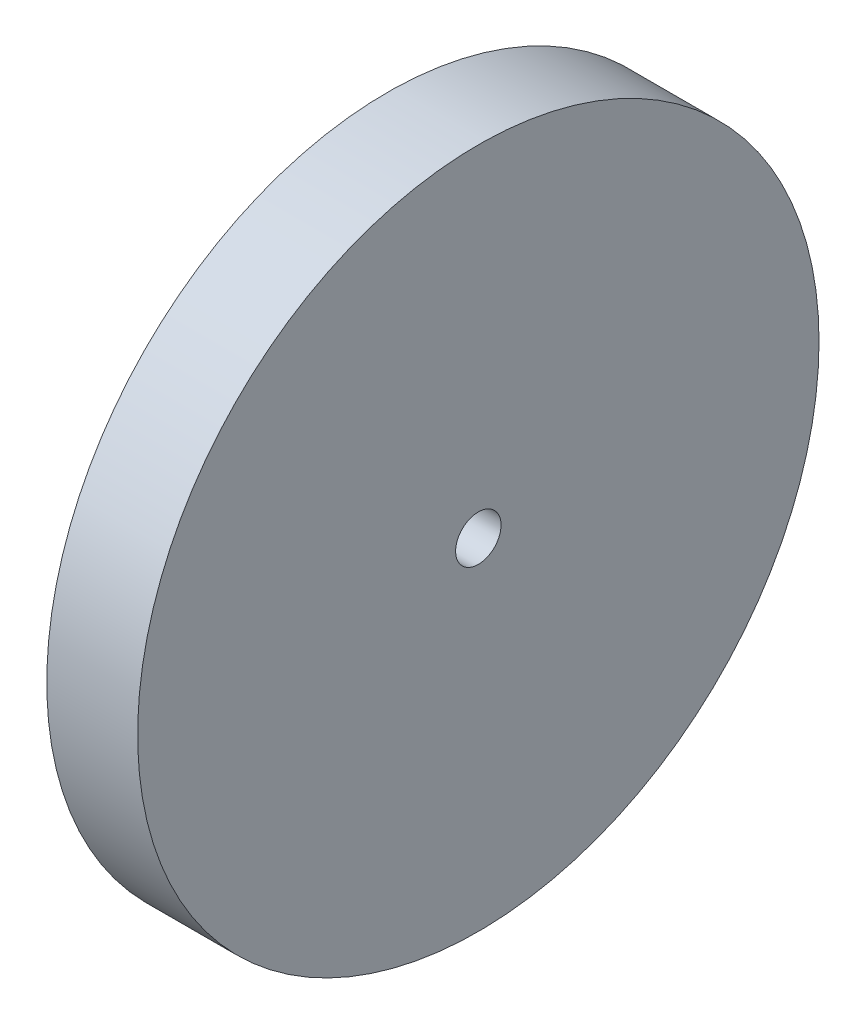
from build123d import *

# Parameters (mm, degrees)
BROCA_DE_ROSQUEAR_PARA_TARRAXA_DE_M2_2X0_REACH = 50.021
BROCA_DE_ROSQUEAR_PARA_TARRAXA_DE_M2_2_R       = 0.875


with BuildPart() as part:
    # Esboço3 → Revolução1 (revolve)
    with BuildSketch(Plane.XY, mode=Mode.PRIVATE) as revolu_o1_sk:
        Polygon((0, 30), (0, 2), (-18, 2), (-18, 5), (-8, 5), (-8, 30), align=None)
    revolve(revolu_o1_sk.sketch.rotate(Axis((0, 0, 0), (-1, 0, 0)), 90), axis=Axis((0, 0, 0), (-1, 0, 0)))

    # Broca de rosquear para tarraxa de M2 2 (on position points) → Broca de rosquear para tarraxa de M2.2x0.451 (cut, up to next)
    with BuildSketch(Plane(origin=(-13.453220178, 5, 0), x_dir=(0, 0, 1), z_dir=(0, 1, 0)), mode=Mode.PRIVATE) as broca_de_rosquear_para_tarraxa_de_m2_2x0_sk1:
        Circle(BROCA_DE_ROSQUEAR_PARA_TARRAXA_DE_M2_2_R)
    broca_de_rosquear_para_tarraxa_de_m2_2x0_tool1 = extrude(broca_de_rosquear_para_tarraxa_de_m2_2x0_sk1.sketch, amount=-BROCA_DE_ROSQUEAR_PARA_TARRAXA_DE_M2_2X0_REACH, mode=Mode.PRIVATE) & part.part
    add(broca_de_rosquear_para_tarraxa_de_m2_2x0_tool1.solids().sort_by_distance((-13.45322, 5, 0))[0], mode=Mode.SUBTRACT)


solid = part.part
